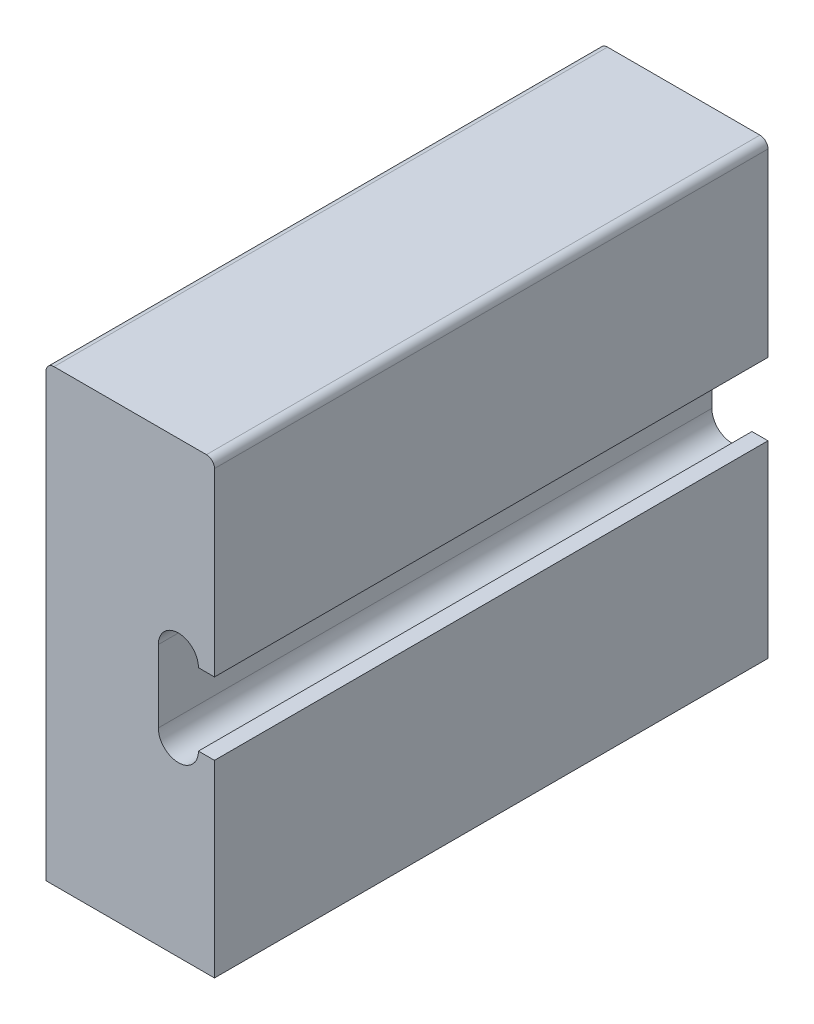
from build123d import *

# Parameters (mm, degrees)
BOSS_EXTRUDE1_DEPTH = 21
FILLET1_R           = 1
CUT_EXTRUDE1_DEPTH  = 78.369244536


with BuildPart() as part:
    # Sketch1 → Boss-Extrude1 (new body)
    with BuildSketch(Plane(origin=(0, 0, 0), x_dir=(0, 0, -1), z_dir=(1, 0, 0))):
        Polygon((-34.5, 0), (-34.5, 28), (34.5, 28), (34.5, -28), (-34.5, -28), align=None)
    extrude(amount=BOSS_EXTRUDE1_DEPTH)

    # Fillet1
    fillet1_edges = [part.edges().sort_by_distance(p)[0] for p in [
        (21, 28, 0),
        (0, 28, 0),
    ]]
    fillet(fillet1_edges, radius=FILLET1_R)

    # Sketch2 → Cut-Extrude1 (cut, through all)
    with BuildSketch(Plane(origin=(0, 0, -34.5), x_dir=(-1, 0, 0), z_dir=(0, 0, -1))):
        with BuildLine():
            Line((-21, -4.5), (-19, -4.5))
            ThreePointArc((-19, -4.5), (-16.5, -7), (-14, -4.5))
            Line((-14, -4.5), (-14, 4.5))
            ThreePointArc((-14, 4.5), (-16.5, 7), (-19, 4.5))
            Line((-19, 4.5), (-21, 4.5))
            Line((-21, 4.5), (-21, -4.5))
        make_face()
    extrude(amount=-CUT_EXTRUDE1_DEPTH, mode=Mode.SUBTRACT)


solid = part.part
